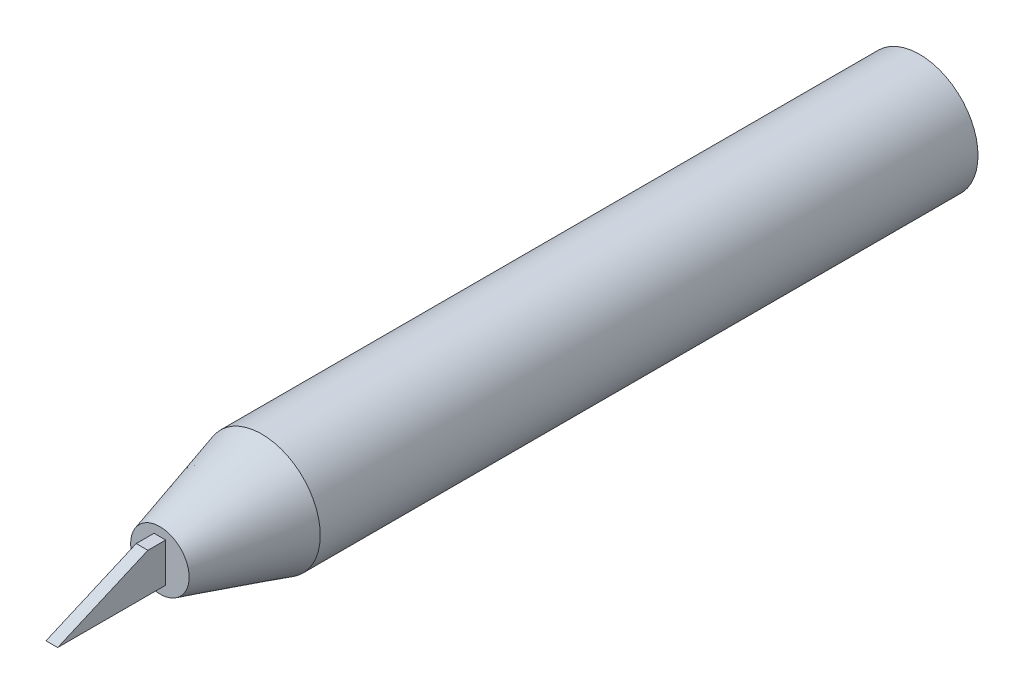
from build123d import *

# Parameters (mm, degrees)
BOSS_EXTRUDE1_DEPTH      = 3
BOSS_EXTRUDE1_DEPTH_BACK = 10
SKETCH1_R                = 1
CHAMFER1_SIZE            = 0.5
CHAMFER1_SIZE2           = 1.743707222
BOSS_EXTRUDE2_DEPTH      = 0.1
BOSS_EXTRUDE2_DEPTH_BACK = 0.1


with BuildPart() as part:
    # Sketch1 → Boss-Extrude1 (new, two sides: drawn at the far end of the back side and taken through both)
    with BuildSketch(Plane.XY.offset(-BOSS_EXTRUDE1_DEPTH_BACK)):
        with Locations((-32.5, -25)):
            Circle(SKETCH1_R)
    extrude(amount=BOSS_EXTRUDE1_DEPTH + BOSS_EXTRUDE1_DEPTH_BACK)

    # Chamfer1
    chamfer1_edges = [part.edges().sort_by_distance(p)[0] for p in [
        (-33.5, -25, 3),
    ]]
    chamfer1_side = [part.faces().sort_by_distance(p)[0] for p in [
        (-32.5, -25, 3),
    ]]
    chamfer(chamfer1_edges, length=CHAMFER1_SIZE, length2=CHAMFER1_SIZE2, reference=chamfer1_side[0])

    # Sketch2 → Boss-Extrude2 (add, two sides: drawn at the far end of the back side and taken through both)
    with BuildSketch(Plane.ZY.offset(32.5).offset(-BOSS_EXTRUDE2_DEPTH_BACK)):
        Polygon((1.471640108, -25.31784203), (4.848999991, -25.31784203), (3.30552546, -24.648450588), (1.471640108, -24.648450588), align=None)
    extrude(amount=BOSS_EXTRUDE2_DEPTH + BOSS_EXTRUDE2_DEPTH_BACK)


solid = part.part
